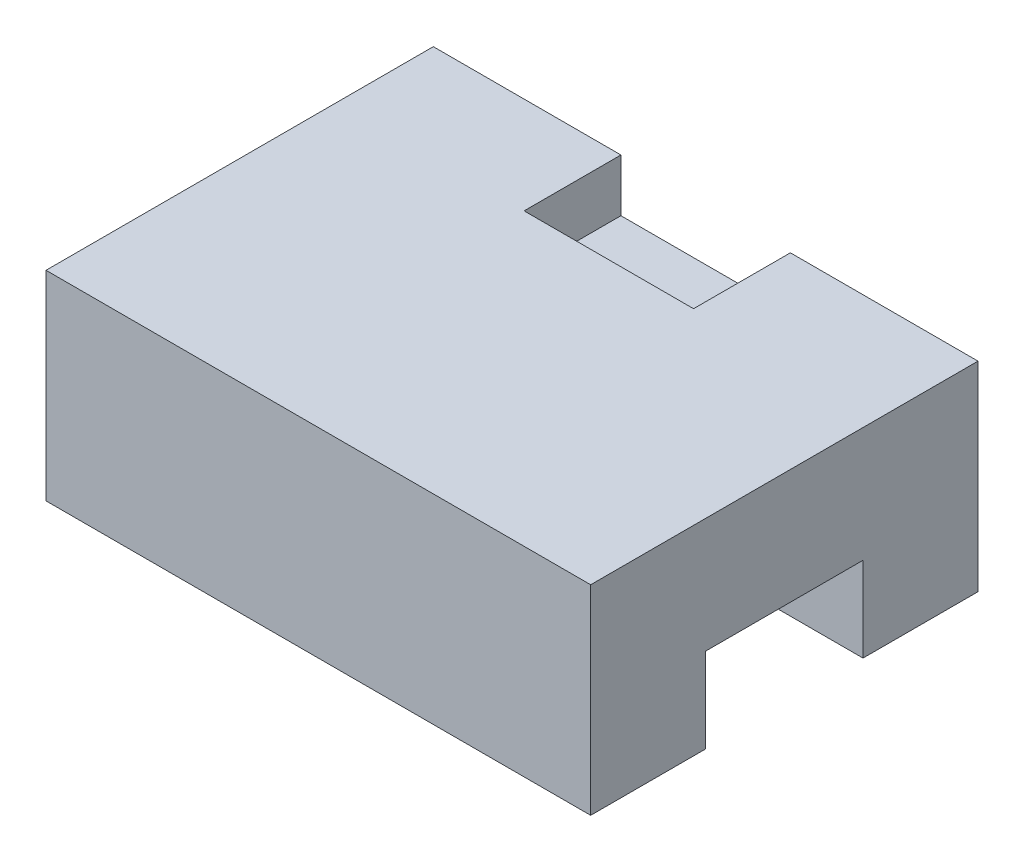
from build123d import *

# Parameters (mm, degrees)
SKETCH1_W           = 90
SKETCH1_H           = 33
BOSS_EXTRUDE1_DEPTH = 64
CUT_EXTRUDE3_REACH  = 113.714
SKETCH2_W           = 26
SKETCH2_H           = 14
SKETCH3_W           = 28
SKETCH3_H           = 8.692638167
CUT_EXTRUDE4_DEPTH  = 16


with BuildPart() as part:
    # Sketch1 → Boss-Extrude1 (new body)
    with BuildSketch(Plane.XY):
        with Locations((-19.35, 0.353571429)):
            Rectangle(SKETCH1_W, SKETCH1_H)
    extrude(amount=-BOSS_EXTRUDE1_DEPTH)

    # Sketch2 → Cut-Extrude3 (cut, up to next)
    with BuildSketch(Plane(origin=(25.65, 0, 0), x_dir=(0, 0, -1), z_dir=(1, 0, 0)), mode=Mode.PRIVATE) as cut_extrude3_sk1:
        with Locations((32, -9.146428571)):
            Rectangle(SKETCH2_W, SKETCH2_H)
    cut_extrude3_tool1 = extrude(cut_extrude3_sk1.sketch, amount=-CUT_EXTRUDE3_REACH, mode=Mode.PRIVATE) & part.part
    add(cut_extrude3_tool1.solids().sort_by_distance((25.65, -9.146429, -32))[0], mode=Mode.SUBTRACT)

    # Sketch3 → Cut-Extrude4 (cut)
    with BuildSketch(Plane(origin=(0, 0, -64), x_dir=(-1, 0, 0), z_dir=(0, 0, -1))):
        with Locations((19.35, 12.507252346)):
            Rectangle(SKETCH3_W, SKETCH3_H)
    extrude(amount=-CUT_EXTRUDE4_DEPTH, mode=Mode.SUBTRACT)


solid = part.part
